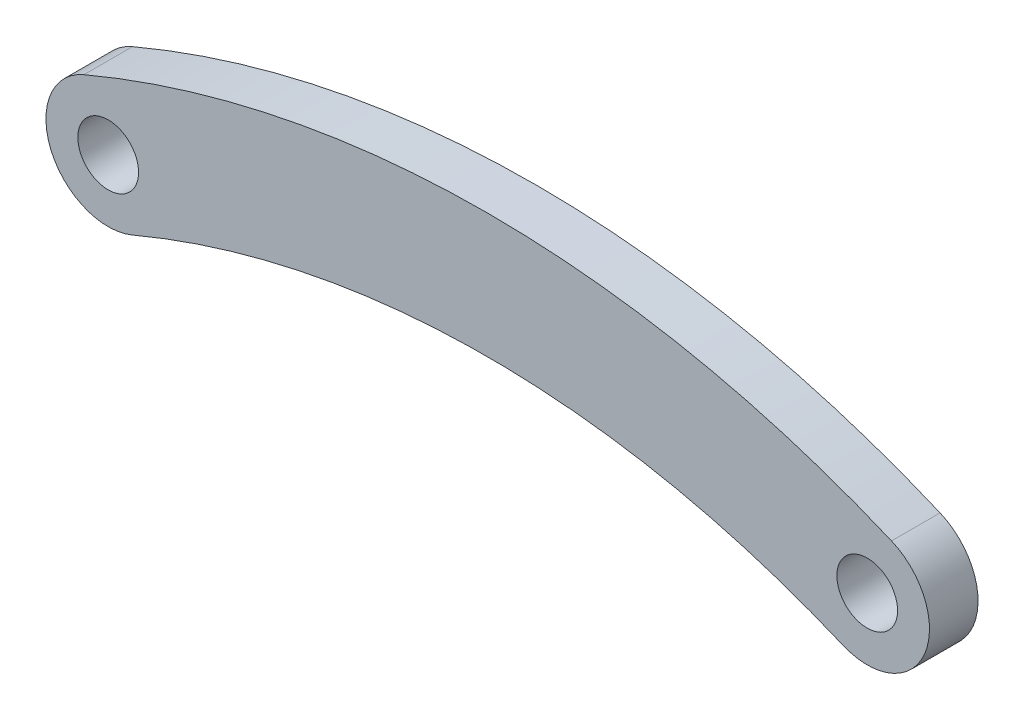
from build123d import *

# Parameters (mm, degrees)
SKETCH3_R           = 1
BOSS_EXTRUDE1_DEPTH = 1.6


with BuildPart() as part:
    # Sketch3 → Boss-Extrude1 (new body)
    with BuildSketch(Plane.XY):
        with BuildLine():
            ThreePointArc((25.799531981, 1.88765691), (12.5, 4.588095622), (-0.799531981, 1.88765691))
            ThreePointArc((-0.799531981, 1.88765691), (-1.88765691, -0.799531981), (0.799531981, -1.88765691))
            ThreePointArc((0.799531981, -1.88765691), (12.5, 0.488095622), (24.200468019, -1.88765691))
            ThreePointArc((24.200468019, -1.88765691), (26.88765691, -0.799531981), (25.799531981, 1.88765691))
        make_face()
        Circle(SKETCH3_R, mode=Mode.SUBTRACT)
        with Locations((25, 0)):
            Circle(SKETCH3_R, mode=Mode.SUBTRACT)
    extrude(amount=BOSS_EXTRUDE1_DEPTH)


solid = part.part
